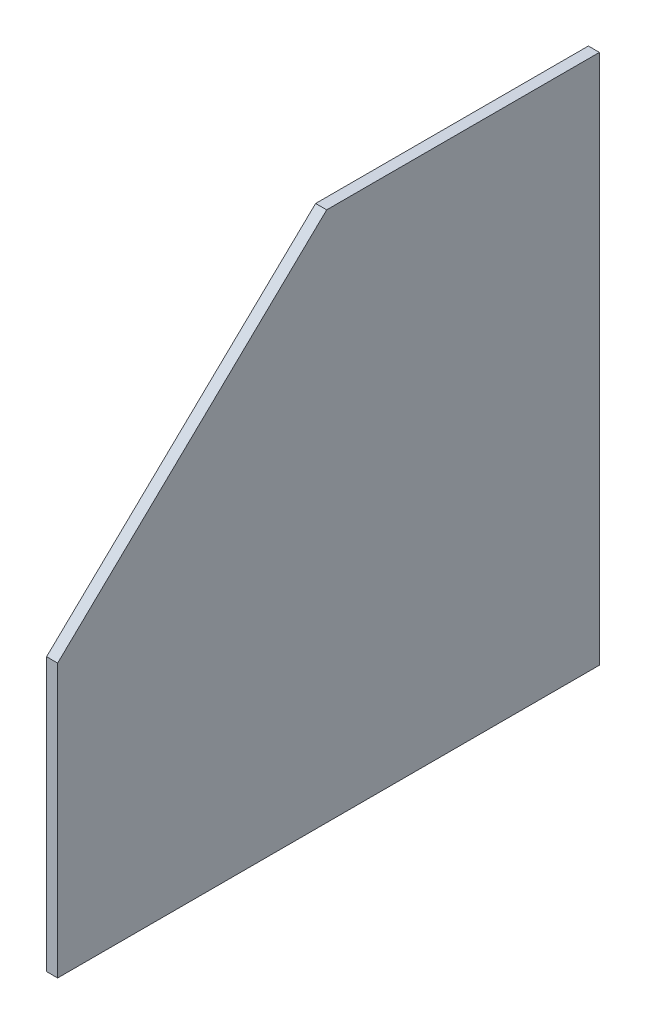
from build123d import *

# Parameters (mm, degrees)
BOSS_EXTRUDE1_DEPTH = 19.05


with BuildPart() as part:
    # Sketch2 → Boss-Extrude1 (new body)
    with BuildSketch(Plane.ZY):
        Polygon((0, 0), (-933.45, 0), (-933.45, 914.4), (-463.55, 914.4), (0, 469.9), align=None)
    extrude(amount=BOSS_EXTRUDE1_DEPTH)


solid = part.part
